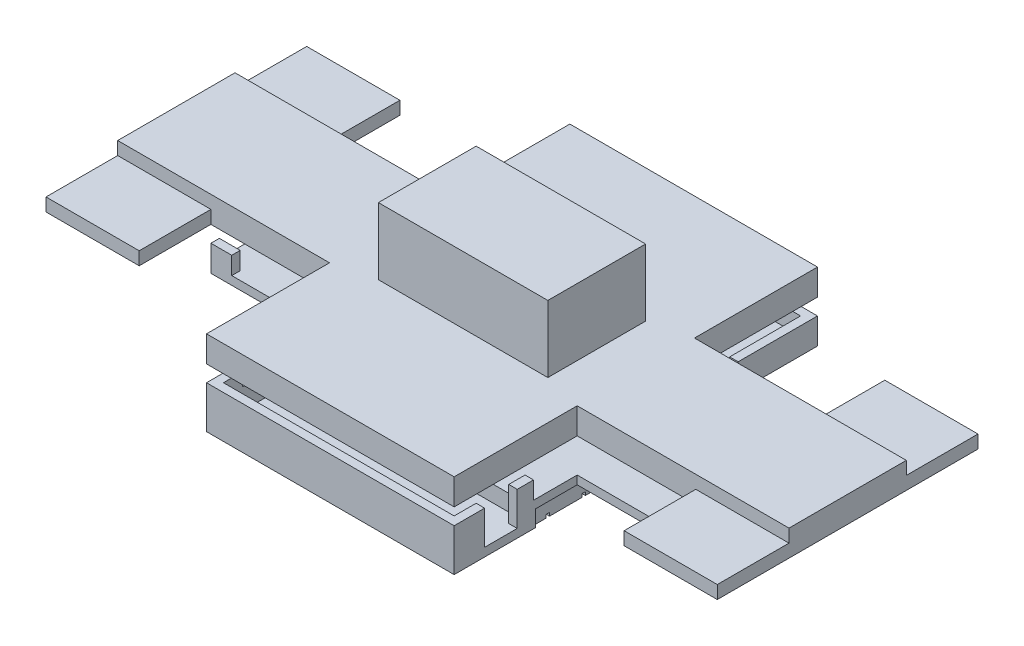
from build123d import *

# Parameters (mm, degrees)
SKETCH1_W               = 33
SKETCH1_H               = 33
BOSS_EXTRUDE1_DEPTH     = 13.6
SKETCH2_W               = 6
SKETCH2_H               = 6
CUT_EXTRUDE1_DEPTH      = 10
LPATTERN1_COUNT         = 5
LPATTERN1_PITCH         = 10.3
LPATTERN2_COUNT         = 2
LPATTERN2_PITCH         = 10.3
SKETCH3_W               = 1
SKETCH3_H               = 33
SKETCH3_W_2             = 33
SKETCH3_H_2             = 1
CUT_EXTRUDE_THIN1_DEPTH = 1
SKETCH4_W               = 76
SKETCH4_H               = 37.75
SKETCH4_H_2             = 36
SKETCH4_W_2             = 65
BOSS_EXTRUDE2_DEPTH     = 8
SHELL1_T                = -2.6
SKETCH5_W               = 40
SKETCH5_H               = 40
BOSS_EXTRUDE3_DEPTH     = 8
SKETCH6_W               = 76
SKETCH6_H               = 25
BOSS_EXTRUDE4_DEPTH     = 5
SHELL2_T                = -2.6
BOSS_EXTRUDE5_DEPTH     = 4
SKETCH8_W               = 8
SKETCH8_H               = 8
CUT_EXTRUDE2_DEPTH      = 2.6
SKETCH9_W               = 52
SKETCH9_H               = 30
BOSS_EXTRUDE6_DEPTH     = 20.5
SKETCH10_W              = 24
SKETCH10_H              = 17.5
CUT_EXTRUDE3_DEPTH      = 49
SKETCH11_W              = 16
SKETCH11_H              = 5.4
CUT_EXTRUDE4_DEPTH      = 2.6
SKETCH13_W              = 30
SKETCH13_H              = 5.4
CUT_EXTRUDE5_DEPTH      = 2.6
MIRROR3_COPY_1_SKETCH_W = 16
MIRROR3_COPY_1_SKETCH_H = 5.4
MIRROR3_COPY_1_DEPTH    = 2.6
MIRROR3_COPY_2_SKETCH_W = 30
MIRROR3_COPY_2_SKETCH_H = 5.4
MIRROR3_COPY_2_DEPTH    = 2.6
SKETCH14_W              = 10
SKETCH14_H              = 10.4
CUT_EXTRUDE6_DEPTH      = 2.6
CUT_EXTRUDE7_DEPTH      = 198.689737973
CUT_EXTRUDE7_DEPTH_BACK = 198.689737973
SKETCH15_W              = 30.8
SKETCH15_H              = 5.4


with BuildPart() as part:
    # Sketch1 → Boss-Extrude1 (new body)
    with BuildSketch(Plane(origin=(0, 0, 0), x_dir=(1, 0, 0), z_dir=(0, 1, 0))):
        Rectangle(SKETCH1_W, SKETCH1_H)
    extrude(amount=BOSS_EXTRUDE1_DEPTH)

    # Sketch2 → Cut-Extrude1 (cut)
    with BuildSketch(Plane(origin=(0, 13.6, 0), x_dir=(1, 0, 0), z_dir=(0, 1, 0))):
        Rectangle(SKETCH2_W, SKETCH2_H)
        with Locations((-10, 0)):
            Rectangle(SKETCH2_W, SKETCH2_H)
        with Locations((10, 0)):
            Rectangle(SKETCH2_W, SKETCH2_H)
    cut_extrude1 = extrude(amount=-CUT_EXTRUDE1_DEPTH, mode=Mode.SUBTRACT)

    # LPattern1: Cut-Extrude1 ×5
    with Locations(*[(0, 0, i * LPATTERN1_PITCH) for i in range(1, LPATTERN1_COUNT)]):
        add(cut_extrude1, mode=Mode.SUBTRACT)

    # LPattern2: Cut-Extrude1 ×2
    with Locations(*[(0, 0, -i * LPATTERN2_PITCH) for i in range(1, LPATTERN2_COUNT)]):
        add(cut_extrude1, mode=Mode.SUBTRACT)

    # Sketch3 → Cut-Extrude-Thin1 (cut)
    with BuildSketch(Plane.XZ):
        with Locations((-5.5, 0)):
            Rectangle(SKETCH3_W, SKETCH3_H)
        with Locations((5.5, 0)):
            Rectangle(SKETCH3_W, SKETCH3_H)
        with Locations((0, 5.5)):
            Rectangle(SKETCH3_W_2, SKETCH3_H_2)
        with Locations((0, -5.5)):
            Rectangle(SKETCH3_W_2, SKETCH3_H_2)
    extrude(amount=-CUT_EXTRUDE_THIN1_DEPTH, mode=Mode.SUBTRACT)


with BuildPart() as body_2:
    # Sketch4 → Boss-Extrude2 (new body)
    with BuildSketch(Plane(origin=(0, 38.6, 0), x_dir=(1, 0, 0), z_dir=(0, 1, 0))):
        with Locations((0, 36.875)):
            Rectangle(SKETCH4_W, SKETCH4_H)
        Rectangle(SKETCH4_W, SKETCH4_H_2)
        with Locations((-70.5, 0)):
            Rectangle(SKETCH4_W_2, SKETCH4_H_2)
        with Locations((0, -36.875)):
            Rectangle(SKETCH4_W, SKETCH4_H)
        with Locations((70.5, 0)):
            Rectangle(SKETCH4_W_2, SKETCH4_H_2)
    extrude(amount=BOSS_EXTRUDE2_DEPTH)

    # Shell1
    shell1_openings = [body_2.faces().sort_by_distance(p)[0] for p in [
        (0, 38.6, 0),
    ]]
    offset(amount=SHELL1_T, openings=shell1_openings, kind=Kind.INTERSECTION)

    # Sketch7 → Boss-Extrude5 (add)
    with BuildSketch(Plane.XZ.offset(-38.6)):
        Polygon((74.4, 15.4), (100.4, 15.4), (100.4, -15.4), (74.4, -15.4), (74.4, -40), (103, -40), (103, 40), (74.4, 40), align=None)
    boss_extrude5 = extrude(amount=-BOSS_EXTRUDE5_DEPTH)

    # Mirror1: Boss-Extrude5 across plane
    add(boss_extrude5.mirror(Plane(origin=(0, 0, 0), x_dir=(0, 0, 1), z_dir=(1, 0, 0))))

    # Sketch9 → Boss-Extrude6 (add)
    with BuildSketch(Plane(origin=(0, 46.6, 0), x_dir=(1, 0, 0), z_dir=(0, 1, 0))):
        Rectangle(SKETCH9_W, SKETCH9_H)
    extrude(amount=BOSS_EXTRUDE6_DEPTH)

    # Sketch10 → Cut-Extrude3 (cut)
    with BuildSketch(Plane.ZY.offset(26)):
        with Locations((0, 55.35)):
            Rectangle(SKETCH10_W, SKETCH10_H)
    extrude(amount=-CUT_EXTRUDE3_DEPTH, mode=Mode.SUBTRACT)


with BuildPart() as body_3:
    # Sketch5 → Boss-Extrude3 (new body)
    with BuildSketch(Plane(origin=(0, 33.6, 0), x_dir=(-1, 0, 0), z_dir=(0, -1, 0))):
        Polygon((-74.4, 18), (-74.4, -18), (-38, -18), (-38, -55.75), (38, -55.75), (38, -18), (74.4, -18), (74.4, 18), (38, 18), (38, 55.75), (-38, 55.75), (-38, 18), align=None)
        Rectangle(SKETCH5_W, SKETCH5_H, mode=Mode.SUBTRACT)
    extrude(amount=BOSS_EXTRUDE3_DEPTH)

    # Sketch6 → Boss-Extrude4 (add)
    with BuildSketch(Plane.XZ.offset(-25.6)):
        with Locations((0, 43.25)):
            Rectangle(SKETCH6_W, SKETCH6_H)
    extrude(amount=BOSS_EXTRUDE4_DEPTH)

    # Shell2
    shell2_openings = [body_3.faces().sort_by_distance(p)[0] for p in [
        (72.540599828, 33.6, 0),
        (-20, 29.6, 0),
        (0, 29.6, -20),
        (20, 29.6, 0),
        (0, 29.6, 20),
    ]]
    offset(amount=SHELL2_T, openings=shell2_openings, kind=Kind.INTERSECTION)

    # Sketch8 → Cut-Extrude2 (cut)
    with BuildSketch(Plane.ZY.offset(38)):
        with Locations((43.25, 33.6)):
            Rectangle(SKETCH8_W, SKETCH8_H)
    extrude(amount=-CUT_EXTRUDE2_DEPTH, mode=Mode.SUBTRACT)

    # Sketch11 → Cut-Extrude4 (cut)
    with BuildSketch(Plane(origin=(38, 0, 0), x_dir=(0, 0, -1), z_dir=(1, 0, 0))):
        with Locations((-23.4, 30.9)):
            Rectangle(SKETCH11_W, SKETCH11_H)
    cut_extrude4 = extrude(amount=-CUT_EXTRUDE4_DEPTH, mode=Mode.SUBTRACT)

    # Sketch13 → Cut-Extrude5 (cut)
    with BuildSketch(Plane.XY.offset(18)):
        with Locations((53, 30.9)):
            Rectangle(SKETCH13_W, SKETCH13_H)
    cut_extrude5 = extrude(amount=-CUT_EXTRUDE5_DEPTH, mode=Mode.SUBTRACT)

    # Mirror2: Cut-Extrude4, Cut-Extrude5 across plane
    add(cut_extrude4.mirror(Plane.XY), mode=Mode.SUBTRACT)
    add(cut_extrude5.mirror(Plane.XY), mode=Mode.SUBTRACT)

    # Mirror3: Cut-Extrude4, Cut-Extrude5 across plane
    add(cut_extrude4.mirror(Plane(origin=(0, 0, 0), x_dir=(0, 0, 1), z_dir=(1, 0, 0))), mode=Mode.SUBTRACT)
    add(cut_extrude5.mirror(Plane(origin=(0, 0, 0), x_dir=(0, 0, 1), z_dir=(1, 0, 0))), mode=Mode.SUBTRACT)

    # Mirror3 copy 1 sketch → Mirror3 copy 1 (cut)
    with BuildSketch(Plane.ZY.offset(38)):
        with Locations((-23.4, 30.9)):
            Rectangle(MIRROR3_COPY_1_SKETCH_W, MIRROR3_COPY_1_SKETCH_H)
    extrude(amount=-MIRROR3_COPY_1_DEPTH, mode=Mode.SUBTRACT)

    # Mirror3 copy 2 sketch → Mirror3 copy 2 (cut)
    with BuildSketch(Plane(origin=(0, 0, -18), x_dir=(-1, 0, 0), z_dir=(0, 0, -1))):
        with Locations((53, 30.9)):
            Rectangle(MIRROR3_COPY_2_SKETCH_W, MIRROR3_COPY_2_SKETCH_H)
    extrude(amount=-MIRROR3_COPY_2_DEPTH, mode=Mode.SUBTRACT)

    # Sketch14 → Cut-Extrude6 (cut)
    with BuildSketch(Plane(origin=(38, 0, 0), x_dir=(0, 0, -1), z_dir=(1, 0, 0))):
        with Locations((-41.4, 28.4)):
            Rectangle(SKETCH14_W, SKETCH14_H)
    extrude(amount=-CUT_EXTRUDE6_DEPTH, mode=Mode.SUBTRACT)

    # Sketch15 → Cut-Extrude7 (cut, two sides: drawn at the far end of the back side and taken through both)
    with BuildSketch(Plane(origin=(74.4, 0, 0), x_dir=(0, 0, -1), z_dir=(1, 0, 0)).offset(-CUT_EXTRUDE7_DEPTH_BACK)):
        with Locations((0, 30.9)):
            Rectangle(SKETCH15_W, SKETCH15_H)
    extrude(amount=CUT_EXTRUDE7_DEPTH + CUT_EXTRUDE7_DEPTH_BACK, mode=Mode.SUBTRACT)


solid = Compound([part.part, body_2.part, body_3.part])
